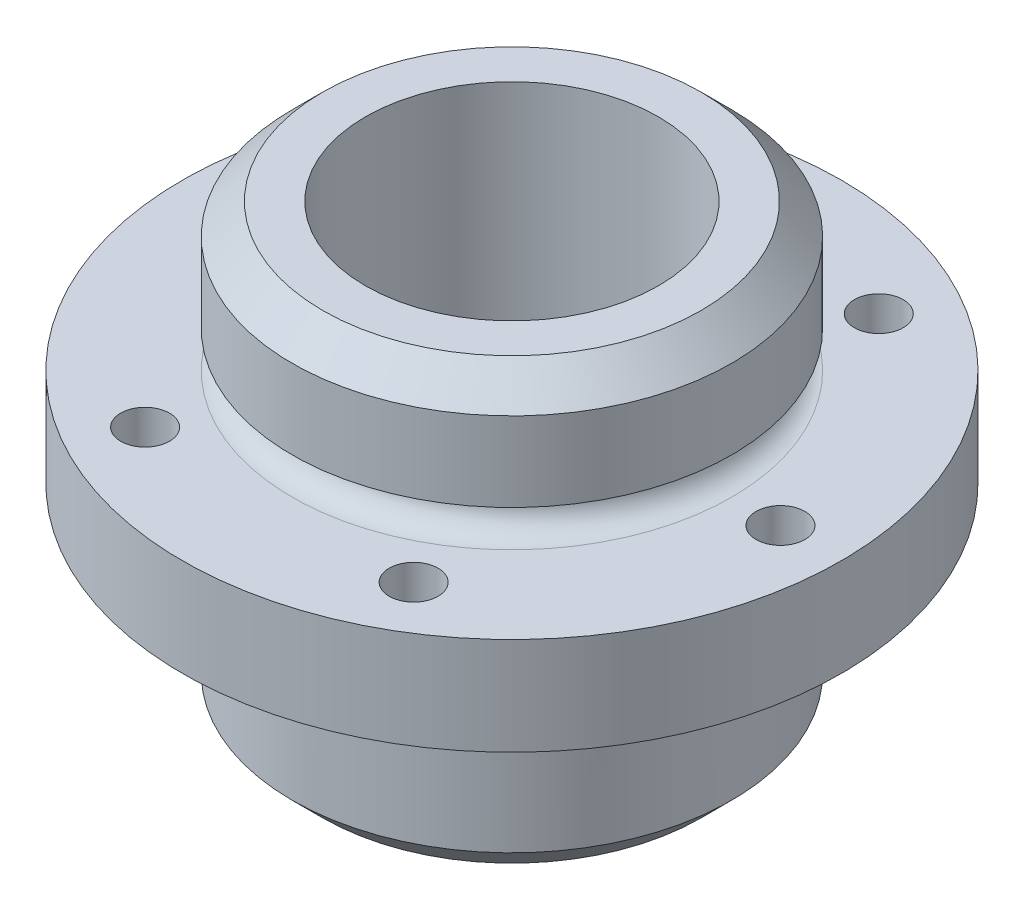
from build123d import *

# Parameters (mm, degrees)
CHAMFER2_SIZE      = 5
FILLET1_R          = 4
CUT_EXTRUDE1_REACH = 92.2
SKETCH2_R          = 4


with BuildPart() as part:
    # Sketch1 → Revolve1 (revolve)
    with BuildSketch(Plane.XY, mode=Mode.PRIVATE) as revolve1_sk:
        with BuildLine():
            ThreePointArc((-36, -12.335343788), (-31.975370241, -10.570389375), (-32, -6.175835683))
            Line((-32, -6.175835683), (-32, -4.335343788))
            Line((-32, -4.335343788), (-54, -4.335343788))
            Line((-54, -4.335343788), (-54, 11.664656212))
            Line((-54, 11.664656212), (-32, 11.664656212))
            Line((-32, 11.664656212), (-32, 17.664656212))
            Line((-32, 17.664656212), (-36, 17.664656212))
            Line((-36, 17.664656212), (-36, 35.664656212))
            Line((-36, 35.664656212), (-24, 35.664656212))
            Line((-24, 35.664656212), (-24, -36.335343788))
            Line((-24, -36.335343788), (-36, -36.335343788))
            Line((-36, -36.335343788), (-36, -12.335343788))
        make_face()
    revolve(revolve1_sk.sketch.rotate(Axis((0, 0, 0), (0, 1, 0)), 270), axis=Axis((0, 0, 0), (0, 1, 0)))

    # Chamfer2
    chamfer2_edges = [part.edges().sort_by_distance(p)[0] for p in [
        (0, 35.664656212, 36),
        (0, -36.335343788, 36),
    ]]
    chamfer(chamfer2_edges, length=CHAMFER2_SIZE)

    # Fillet1
    fillet1_edges = [part.edges().sort_by_distance(p)[0] for p in [
        (0, 11.664656212, 32),
    ]]
    fillet(fillet1_edges, radius=FILLET1_R)

    # Sketch2 → Cut-Extrude1 (cut, up to next)
    with BuildSketch(Plane(origin=(0, 11.664656212, 0), x_dir=(1, 0, 0), z_dir=(0, 1, 0)), mode=Mode.PRIVATE) as cut_extrude1_sk1:
        with Locations(Location((44, 0, 0), (0, 0, 270))):
            Circle(SKETCH2_R)
    cut_extrude1_tool1 = extrude(cut_extrude1_sk1.sketch, amount=-CUT_EXTRUDE1_REACH, mode=Mode.PRIVATE) & part.part
    # Sketch2 → Cut-Extrude1 (cut, up to next)
    with BuildSketch(Plane(origin=(0, 11.664656212, 0), x_dir=(1, 0, 0), z_dir=(0, 1, 0)), mode=Mode.PRIVATE) as cut_extrude1_sk2:
        with Locations(Location((22, -38.105117767, 0), (0, 0, 270))):
            Circle(SKETCH2_R)
    cut_extrude1_tool2 = extrude(cut_extrude1_sk2.sketch, amount=-CUT_EXTRUDE1_REACH, mode=Mode.PRIVATE) & part.part
    # Sketch2 → Cut-Extrude1 (cut, up to next)
    with BuildSketch(Plane(origin=(0, 11.664656212, 0), x_dir=(1, 0, 0), z_dir=(0, 1, 0)), mode=Mode.PRIVATE) as cut_extrude1_sk3:
        with Locations(Location((-22, -38.105117767, 0), (0, 0, 270))):
            Circle(SKETCH2_R)
    cut_extrude1_tool3 = extrude(cut_extrude1_sk3.sketch, amount=-CUT_EXTRUDE1_REACH, mode=Mode.PRIVATE) & part.part
    # Sketch2 → Cut-Extrude1 (cut, up to next)
    with BuildSketch(Plane(origin=(0, 11.664656212, 0), x_dir=(1, 0, 0), z_dir=(0, 1, 0)), mode=Mode.PRIVATE) as cut_extrude1_sk4:
        with Locations(Location((-44, 0, 0), (0, 0, 270))):
            Circle(SKETCH2_R)
    cut_extrude1_tool4 = extrude(cut_extrude1_sk4.sketch, amount=-CUT_EXTRUDE1_REACH, mode=Mode.PRIVATE) & part.part
    # Sketch2 → Cut-Extrude1 (cut, up to next)
    with BuildSketch(Plane(origin=(0, 11.664656212, 0), x_dir=(1, 0, 0), z_dir=(0, 1, 0)), mode=Mode.PRIVATE) as cut_extrude1_sk5:
        with Locations(Location((-22, 38.105117767, 0), (0, 0, 270))):
            Circle(SKETCH2_R)
    cut_extrude1_tool5 = extrude(cut_extrude1_sk5.sketch, amount=-CUT_EXTRUDE1_REACH, mode=Mode.PRIVATE) & part.part
    # Sketch2 → Cut-Extrude1 (cut, up to next)
    with BuildSketch(Plane(origin=(0, 11.664656212, 0), x_dir=(1, 0, 0), z_dir=(0, 1, 0)), mode=Mode.PRIVATE) as cut_extrude1_sk6:
        with Locations(Location((22, 38.105117767, 0), (0, 0, 270))):
            Circle(SKETCH2_R)
    cut_extrude1_tool6 = extrude(cut_extrude1_sk6.sketch, amount=-CUT_EXTRUDE1_REACH, mode=Mode.PRIVATE) & part.part
    add(cut_extrude1_tool1.solids().sort_by_distance((44, 11.664656, 0))[0], mode=Mode.SUBTRACT)
    add(cut_extrude1_tool2.solids().sort_by_distance((22, 11.664656, 38.105118))[0], mode=Mode.SUBTRACT)
    add(cut_extrude1_tool3.solids().sort_by_distance((-22, 11.664656, 38.105118))[0], mode=Mode.SUBTRACT)
    add(cut_extrude1_tool4.solids().sort_by_distance((-44, 11.664656, 0))[0], mode=Mode.SUBTRACT)
    add(cut_extrude1_tool5.solids().sort_by_distance((-22, 11.664656, -38.105118))[0], mode=Mode.SUBTRACT)
    add(cut_extrude1_tool6.solids().sort_by_distance((22, 11.664656, -38.105118))[0], mode=Mode.SUBTRACT)


solid = part.part
